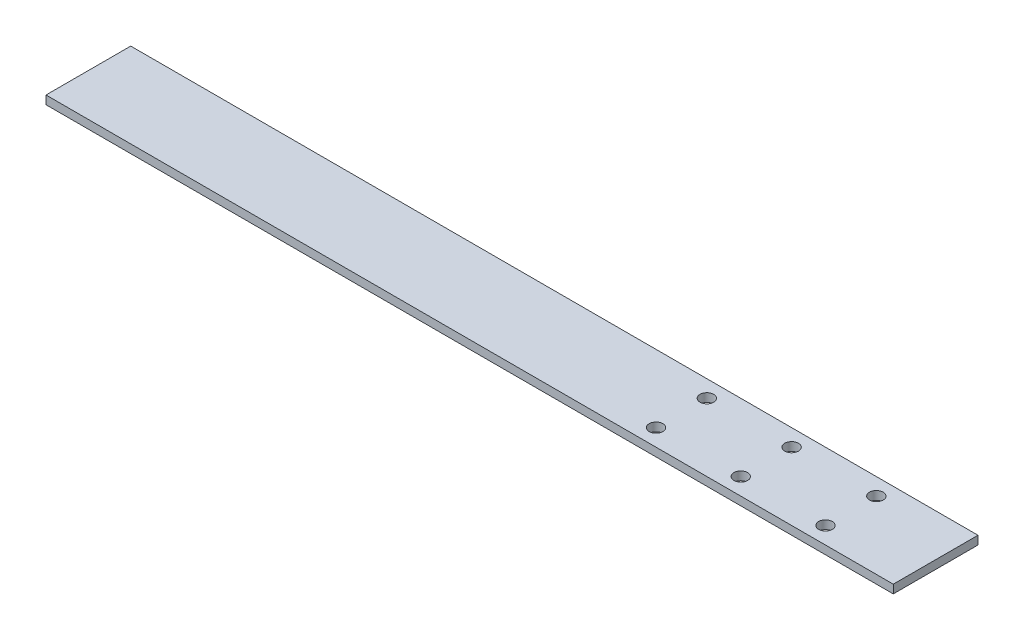
from build123d import *

# Parameters (mm, degrees)
SKETCH1_W           = 500
SKETCH1_H           = 50
BOSS_EXTRUDE1_DEPTH = 5
SKETCH2_R           = 4.05
CUT_EXTRUDE1_DEPTH  = 32


with BuildPart() as part:
    # Sketch1 → Boss-Extrude1 (new body)
    with BuildSketch(Plane(origin=(0, 0, 0), x_dir=(1, 0, 0), z_dir=(0, 1, 0))):
        with Locations((250, 25)):
            Rectangle(SKETCH1_W, SKETCH1_H)
    extrude(amount=BOSS_EXTRUDE1_DEPTH)

    # Sketch2 → Cut-Extrude1 (cut)
    with BuildSketch(Plane(origin=(0, 5, 0), x_dir=(1, 0, 0), z_dir=(0, 1, 0))):
        with Locations(Location((450, 10, 0), (0, 0, 270))):
            Circle(SKETCH2_R)
        with Locations(Location((450, 40, 0), (0, 0, 270))):
            Circle(SKETCH2_R)
        with Locations(Location((400, 40, 0), (0, 0, 270))):
            Circle(SKETCH2_R)
        with Locations(Location((400, 10, 0), (0, 0, 270))):
            Circle(SKETCH2_R)
        with Locations(Location((350, 40, 0), (0, 0, 270))):
            Circle(SKETCH2_R)
        with Locations(Location((350, 10, 0), (0, 0, 270))):
            Circle(SKETCH2_R)
    extrude(amount=-CUT_EXTRUDE1_DEPTH, mode=Mode.SUBTRACT)


solid = part.part
